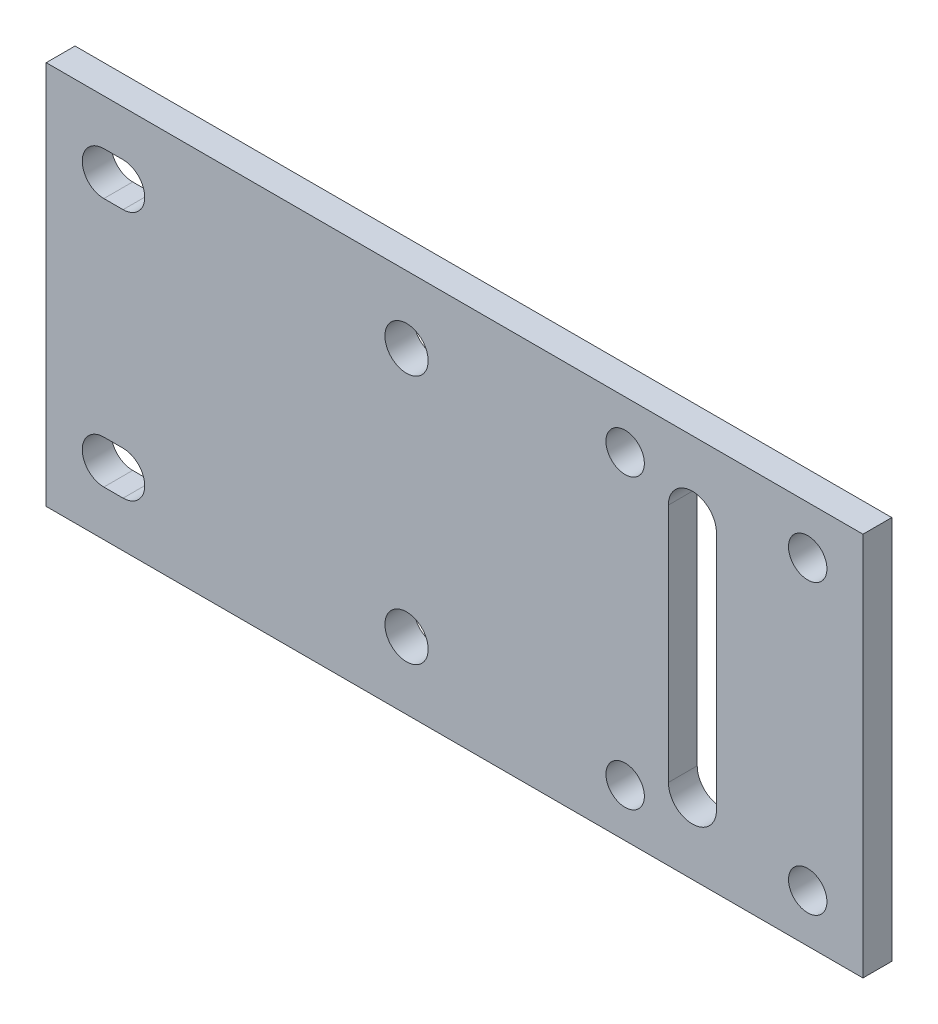
from build123d import *

# Parameters (mm, degrees)
SKETCH_1_W      = 85
SKETCH_1_H      = 40
SKETCH_1_R      = 2.25
SKETCH_1_R_2    = 2
EXTRUDE_1_DEPTH = 3


with BuildPart() as part:
    # 草图1 → 凸台-拉伸1 (new body)
    with BuildSketch(Plane.XY):
        with Locations((20.25, 0)):
            Rectangle(SKETCH_1_W, SKETCH_1_H)
        with Locations((15.25, 13)):
            Circle(SKETCH_1_R, mode=Mode.SUBTRACT)
        with Locations((15.25, -13)):
            Circle(SKETCH_1_R, mode=Mode.SUBTRACT)
        with Locations((57, 15)):
            Circle(SKETCH_1_R_2, mode=Mode.SUBTRACT)
        with Locations((38, 15)):
            Circle(SKETCH_1_R_2, mode=Mode.SUBTRACT)
        with Locations(Location((57, -15, 0), (0, 0, 180))):
            Circle(SKETCH_1_R_2, mode=Mode.SUBTRACT)
        with Locations(Location((38, -15, 0), (0, 0, 180))):
            Circle(SKETCH_1_R_2, mode=Mode.SUBTRACT)
        with BuildLine():
            Line((-14.25, 10.75), (-16.25, 10.75))
            ThreePointArc((-16.25, 10.75), (-18.5, 13), (-16.25, 15.25))
            Line((-16.25, 15.25), (-14.25, 15.25))
            ThreePointArc((-14.25, 15.25), (-12, 13), (-14.25, 10.75))
        make_face(mode=Mode.SUBTRACT)
        with BuildLine():
            Line((-14.25, -15.25), (-16.25, -15.25))
            ThreePointArc((-16.25, -15.25), (-18.5, -13), (-16.25, -10.75))
            Line((-16.25, -10.75), (-14.25, -10.75))
            ThreePointArc((-14.25, -10.75), (-12, -13), (-14.25, -15.25))
        make_face(mode=Mode.SUBTRACT)
        with BuildLine():
            Line((42.5, -12.5), (42.5, 12.5))
            ThreePointArc((42.5, 12.5), (45, 15), (47.5, 12.5))
            Line((47.5, 12.5), (47.5, -12.5))
            ThreePointArc((47.5, -12.5), (45, -15), (42.5, -12.5))
        make_face(mode=Mode.SUBTRACT)
    extrude(amount=EXTRUDE_1_DEPTH)


solid = part.part
